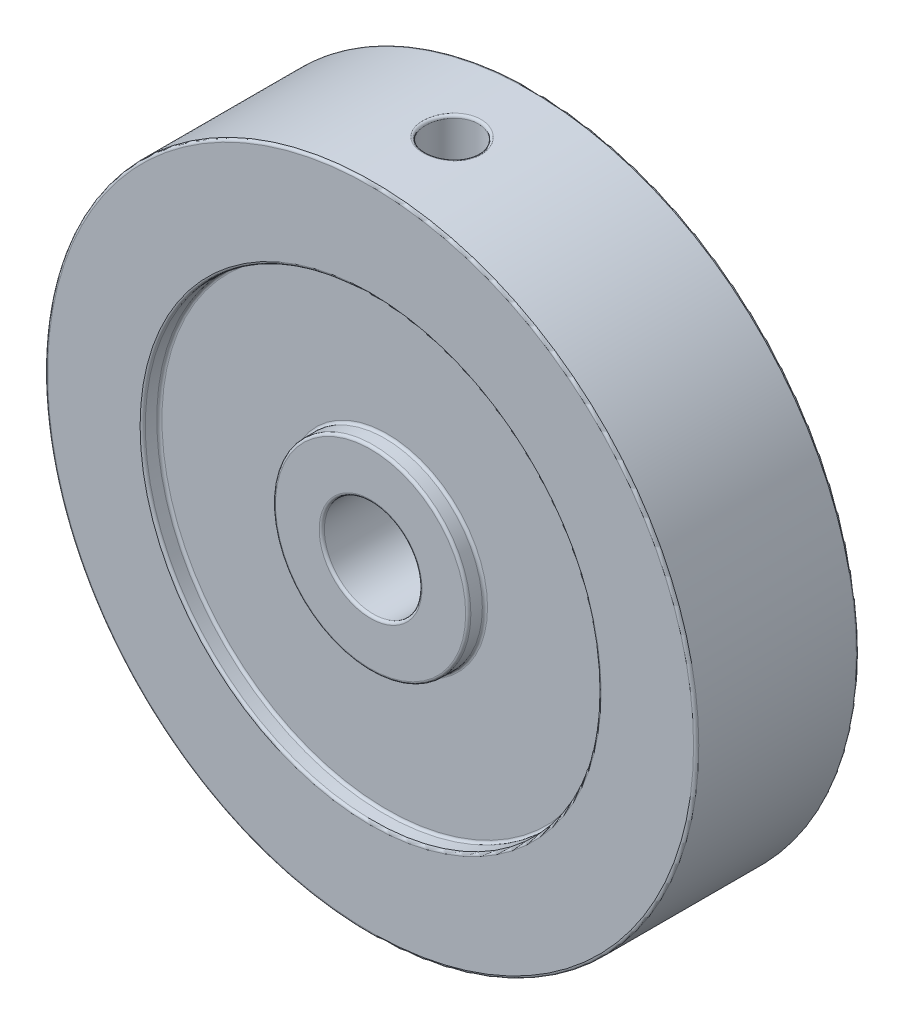
from build123d import *

# Parameters (mm, degrees)
SKETCH1_R                 = 15.875
BOSS_EXTRUDE1_DEPTH       = 3.96875
SKETCH2_R                 = 2.38125
CUT_EXTRUDE1_DEPTH        = 24.8125
SKETCH2_3_R               = 11.1125
SKETCH2_3_R_2             = 4.7625
CUT_EXTRUDE2_DEPTH        = 0.8128
F_5_40_TAPPED_HOLE1_D     = 2.5781
F_5_40_TAPPED_HOLE1_DEPTH = 16.383
F_5_40_TAPPED_HOLE1_TIP   = 0.774539381
FILLET1_R                 = 0.127


with BuildPart() as part:
    # Sketch1 → Boss-Extrude1 (new, symmetric)
    with BuildSketch(Plane.XY):
        Circle(SKETCH1_R)
    extrude(amount=BOSS_EXTRUDE1_DEPTH, both=True)

    # Sketch2 → Cut-Extrude1 (cut, through all)
    with BuildSketch(Plane.XY.offset(3.96875)):
        Circle(SKETCH2_R)
    extrude(amount=-CUT_EXTRUDE1_DEPTH, mode=Mode.SUBTRACT)

    # Sketch2<3> → Cut-Extrude2 (cut)
    with BuildSketch(Plane.XY.offset(3.96875)):
        Circle(SKETCH2_3_R)
        Circle(SKETCH2_3_R_2, mode=Mode.SUBTRACT)
    cut_extrude2 = extrude(amount=-CUT_EXTRUDE2_DEPTH, mode=Mode.SUBTRACT)

    # Mirror1: Cut-Extrude2 across plane
    add(cut_extrude2.mirror(Plane.XY), mode=Mode.SUBTRACT)

    # #5-40 Tapped Hole1
    with Locations(Plane(origin=(0, 15.875, 0), x_dir=(1, 0, 0), z_dir=(0, 1, 0))):
        with Locations((0, 0)):
            Hole(F_5_40_TAPPED_HOLE1_D / 2, depth=F_5_40_TAPPED_HOLE1_DEPTH)
            with Locations((0, 0, -(F_5_40_TAPPED_HOLE1_DEPTH + F_5_40_TAPPED_HOLE1_TIP / 2))):  # 118° drill point
                Cone(0, F_5_40_TAPPED_HOLE1_D / 2, F_5_40_TAPPED_HOLE1_TIP, mode=Mode.SUBTRACT)

    # Fillet1
    fillet1_edges = [part.edges().sort_by_distance(p)[0] for p in [
        (-11.1125, 0, -3.96875),
        (-4.7625, 0, -3.96875),
        (-2.38125, 0, -3.96875),
        (-11.1125, 0, -3.15595),
        (-4.7625, 0, -3.15595),
        (-4.7625, 0, 3.96875),
        (-2.38125, 0, 3.96875),
        (-11.1125, 0, 3.15595),
        (-4.7625, 0, 3.15595),
        (-11.1125, 0, 3.96875),
        (-15.875, 0, -3.96875),
        (-15.875, 0, 3.96875),
        (1.289050005, 15.822578017, 2e-09),
    ]]
    fillet(fillet1_edges, radius=FILLET1_R)


solid = part.part
